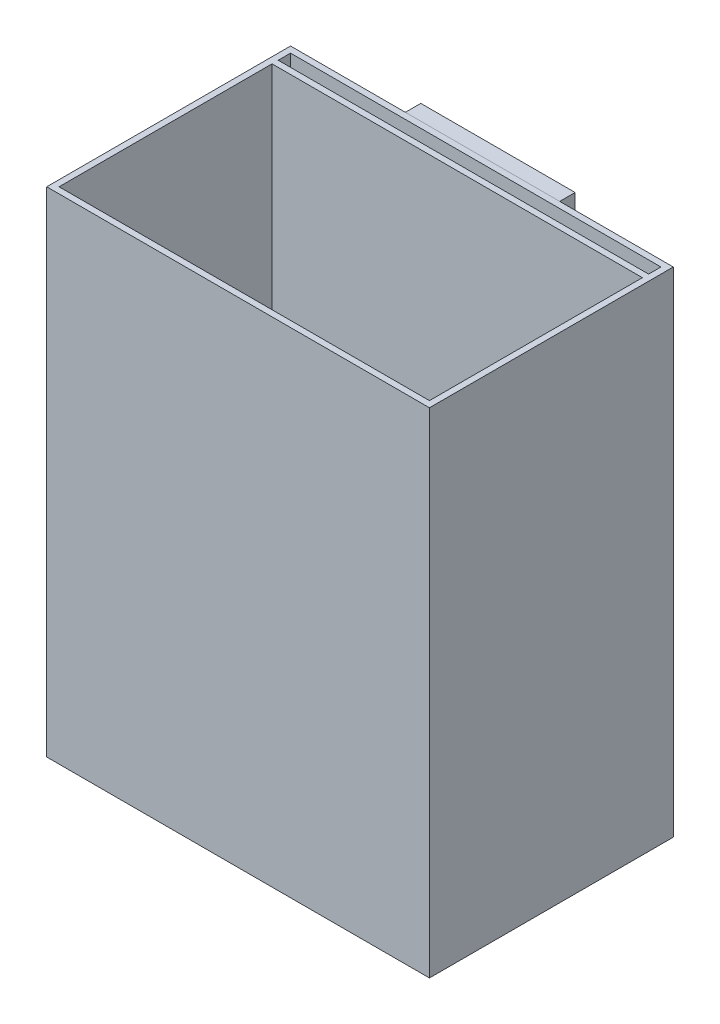
from build123d import *

# Parameters (mm, degrees)
SKETCH1_W           = 6200
SKETCH1_H           = 8000
BOSS_EXTRUDE1_DEPTH = 100
SKETCH2_W           = 6200
SKETCH2_H           = 100
BOSS_EXTRUDE2_DEPTH = 3850
SKETCH3_W           = 6200
SKETCH3_H           = 8000
BOSS_EXTRUDE3_DEPTH = 100
SKETCH5_W           = 3750
SKETCH5_H           = 7900
BOSS_EXTRUDE4_DEPTH = 100
SKETCH6_W           = 3750
SKETCH6_H           = 7900
BOSS_EXTRUDE5_DEPTH = 100
SKETCH7_W           = 2500
SKETCH7_H           = 1800
BOSS_EXTRUDE6_DEPTH = 260
SKETCH8_W           = 6100
SKETCH8_H           = 198.276900897
BOSS_EXTRUDE7_DEPTH = 3550
SKETCH9_W           = 6000
SKETCH9_H           = 100
BOSS_EXTRUDE8_DEPTH = 6400


with BuildPart() as part:
    # Sketch1 → Boss-Extrude1 (new body)
    with BuildSketch(Plane.XY):
        with Locations((3100, 4000)):
            Rectangle(SKETCH1_W, SKETCH1_H)
    extrude(amount=BOSS_EXTRUDE1_DEPTH)

    # Sketch2 → Boss-Extrude2 (add)
    with BuildSketch(Plane.XY.offset(100)):
        with Locations((3100, 50)):
            Rectangle(SKETCH2_W, SKETCH2_H)
    extrude(amount=BOSS_EXTRUDE2_DEPTH)

    # Sketch3 → Boss-Extrude3 (add)
    with BuildSketch(Plane.XY.offset(3950)):
        with Locations((3100, 4000)):
            Rectangle(SKETCH3_W, SKETCH3_H)
    extrude(amount=-BOSS_EXTRUDE3_DEPTH)

    # Sketch5 → Boss-Extrude4 (add)
    with BuildSketch(Plane(origin=(6200, 0, 0), x_dir=(0, 0, -1), z_dir=(1, 0, 0))):
        with Locations((-1975, 4050)):
            Rectangle(SKETCH5_W, SKETCH5_H)
    extrude(amount=-BOSS_EXTRUDE4_DEPTH)

    # Sketch6 → Boss-Extrude5 (add)
    with BuildSketch(Plane.ZY):
        with Locations((1975, 4050)):
            Rectangle(SKETCH6_W, SKETCH6_H)
    extrude(amount=-BOSS_EXTRUDE5_DEPTH)

    # Sketch7 → Boss-Extrude6 (add)
    with BuildSketch(Plane(origin=(0, 0, 0), x_dir=(-1, 0, 0), z_dir=(0, 0, -1))):
        with Locations((-3100, 7090)):
            Rectangle(SKETCH7_W, SKETCH7_H)
    extrude(amount=BOSS_EXTRUDE6_DEPTH)

    # Sketch8 → Boss-Extrude7 (add)
    with BuildSketch(Plane(origin=(0, 0, 3850), x_dir=(-1, 0, 0), z_dir=(0, 0, -1))):
        with Locations((-3050, 1500.861549552)):
            Rectangle(SKETCH8_W, SKETCH8_H)
    extrude(amount=BOSS_EXTRUDE7_DEPTH)

    # Sketch9 → Boss-Extrude8 (add)
    with BuildSketch(Plane(origin=(0, 1600, 0), x_dir=(1, 0, 0), z_dir=(0, 1, 0))):
        with Locations((3100, -350)):
            Rectangle(SKETCH9_W, SKETCH9_H)
    extrude(amount=BOSS_EXTRUDE8_DEPTH)


solid = part.part
